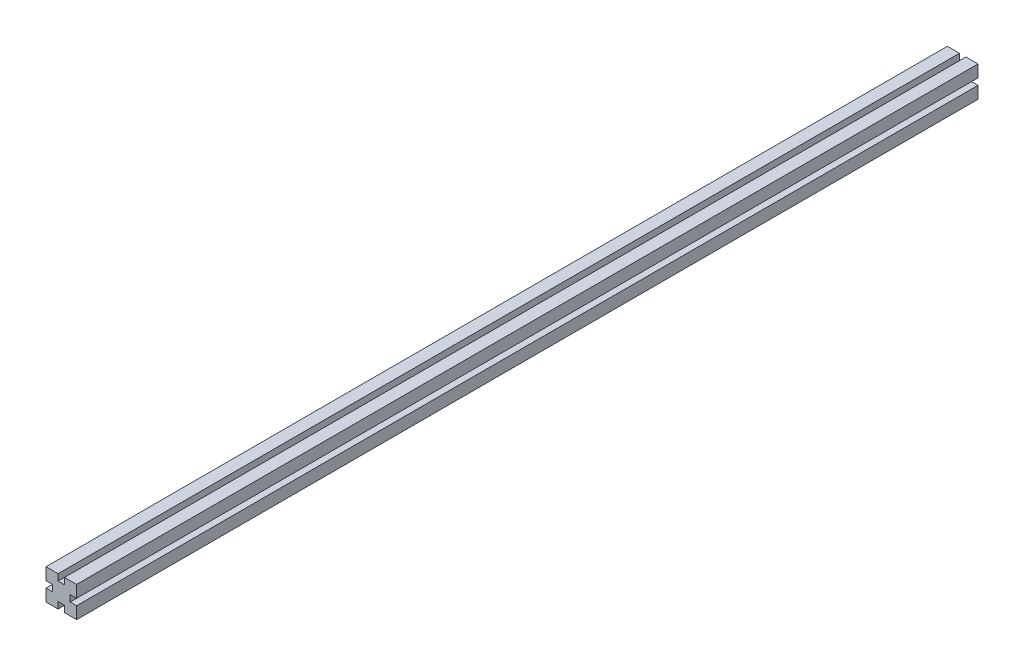
from build123d import *

# Parameters (mm, degrees)
PROFILE_DEPTH = 1122


with BuildPart() as part:
    # Sketch1 → Profile (new body)
    with BuildSketch(Plane.XY):
        Polygon((-19.05, -19.05), (-4, -19.05), (-4, -11.05), (4, -11.05), (4, -19.05), (19.05, -19.05), (19.05, -4), (11.05, -4), (11.05, 4), (19.05, 4), (19.05, 19.05), (4, 19.05), (4, 11.05), (-4, 11.05), (-4, 19.05), (-19.05, 19.05), (-19.05, 4), (-11.05, 4), (-11.05, -4), (-19.05, -4), align=None)
    extrude(amount=PROFILE_DEPTH)


solid = part.part
